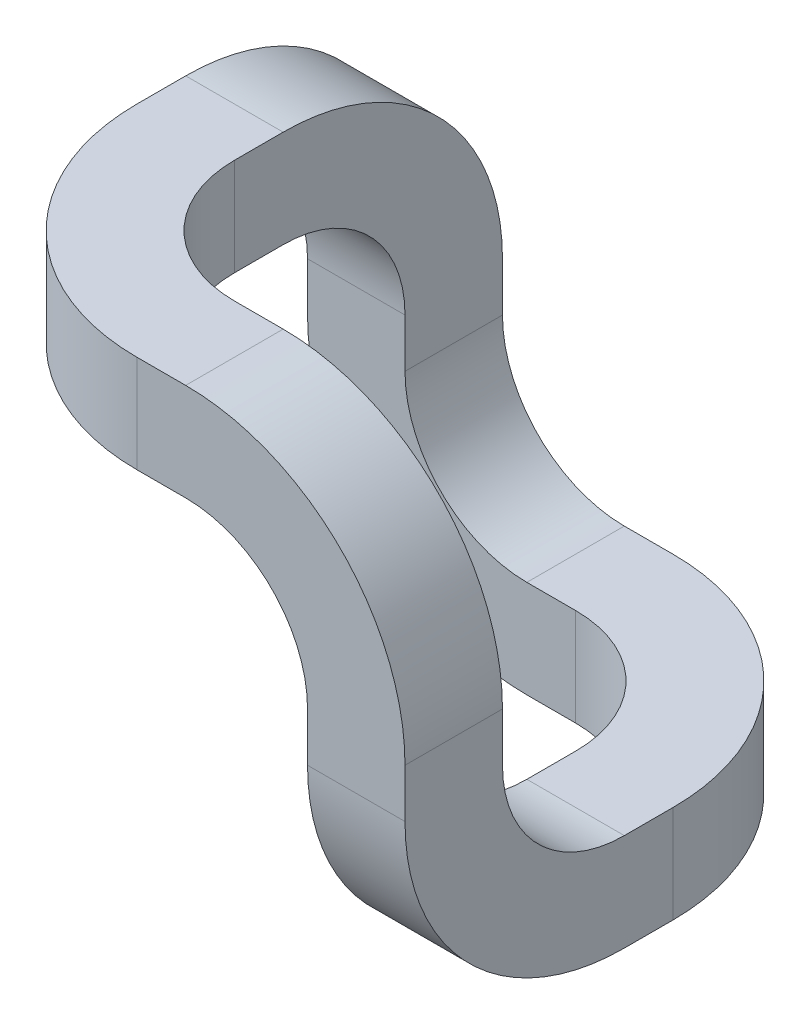
from build123d import *

# Parameters (mm, degrees)
SKETCH1_W               = 20
SKETCH1_H               = 20
BOSS_EXTRUDE1_DEPTH     = 10
SKETCH2_W               = 12
SKETCH2_H               = 12
CUT_EXTRUDE1_DEPTH      = 19
SKETCH3_W               = 12
SKETCH3_H               = 12
CUT_EXTRUDE2_DEPTH      = 31
SKETCH4_W               = 12
SKETCH4_H               = 12
CUT_EXTRUDE3_DEPTH      = 39
CUT_EXTRUDE5_DEPTH      = 21
CUT_EXTRUDE5_DEPTH_BACK = 6
SKETCH5_W               = 16
SKETCH5_H               = 16
CUT_EXTRUDE8_START      = 4
SKETCH6_W               = 17.478582849
SKETCH6_H               = 18.231479144
CUT_EXTRUDE8_DEPTH      = 43
FILLET3_R               = 9
FILLET4_R               = 9
FILLET5_R               = 9
FILLET6_R               = 9
FILLET7_R               = 9
FILLET8_R               = 9
FILLET9_R               = 5
FILLET10_R              = 5
FILLET11_R              = 5
FILLET12_R              = 5
FILLET13_R              = 5
FILLET14_R              = 5


with BuildPart() as part:
    # Sketch1 → Boss-Extrude1 (new, symmetric)
    with BuildSketch(Plane.XY):
        with Locations((10, 10)):
            Rectangle(SKETCH1_W, SKETCH1_H)
    extrude(amount=BOSS_EXTRUDE1_DEPTH, both=True)

    # Sketch2 → Cut-Extrude1 (cut, symmetric)
    with BuildSketch(Plane.XY):
        with Locations((10, 10)):
            Rectangle(SKETCH2_W, SKETCH2_H)
    extrude(amount=CUT_EXTRUDE1_DEPTH, both=True, mode=Mode.SUBTRACT)

    # Sketch3 → Cut-Extrude2 (cut, symmetric)
    with BuildSketch(Plane(origin=(0, 0, 0), x_dir=(1, 0, 0), z_dir=(0, 1, 0))):
        with Locations((10, 0)):
            Rectangle(SKETCH3_W, SKETCH3_H)
    extrude(amount=CUT_EXTRUDE2_DEPTH, both=True, mode=Mode.SUBTRACT)

    # Sketch4 → Cut-Extrude3 (cut, symmetric)
    with BuildSketch(Plane(origin=(0, 0, 0), x_dir=(0, 0, -1), z_dir=(1, 0, 0))):
        with Locations((0, 10)):
            Rectangle(SKETCH4_W, SKETCH4_H)
    extrude(amount=CUT_EXTRUDE3_DEPTH, both=True, mode=Mode.SUBTRACT)

    # Sketch5 → Cut-Extrude5 (cut, two sides: drawn at the far end of the back side and taken through both)
    with BuildSketch(Plane.XY.offset(-CUT_EXTRUDE5_DEPTH_BACK)):
        with Locations((8, 8)):
            Rectangle(SKETCH5_W, SKETCH5_H)
    extrude(amount=CUT_EXTRUDE5_DEPTH + CUT_EXTRUDE5_DEPTH_BACK, mode=Mode.SUBTRACT)

    # Sketch6 → Cut-Extrude8 (cut)
    with BuildSketch(Plane(origin=(0, 0, 0), x_dir=(1, 0, 0), z_dir=(0, 1, 0)).offset(CUT_EXTRUDE8_START)):
        with Locations((12.739291425, 3.115739572)):
            Rectangle(SKETCH6_W, SKETCH6_H)
    extrude(amount=CUT_EXTRUDE8_DEPTH, mode=Mode.SUBTRACT)

    # Fillet3
    fillet3_edges = [part.edges().sort_by_distance(p)[0] for p in [
        (20, 20, 8),
    ]]
    fillet(fillet3_edges, radius=FILLET3_R)

    # Fillet4
    fillet4_edges = [part.edges().sort_by_distance(p)[0] for p in [
        (0, 0, -8),
    ]]
    fillet(fillet4_edges, radius=FILLET4_R)

    # Fillet5
    fillet5_edges = [part.edges().sort_by_distance(p)[0] for p in [
        (20, 2, -10),
    ]]
    fillet(fillet5_edges, radius=FILLET5_R)

    # Fillet6
    fillet6_edges = [part.edges().sort_by_distance(p)[0] for p in [
        (0, 18, 10),
    ]]
    fillet(fillet6_edges, radius=FILLET6_R)

    # Fillet7
    fillet7_edges = [part.edges().sort_by_distance(p)[0] for p in [
        (2, 20, -10),
    ]]
    fillet(fillet7_edges, radius=FILLET7_R)

    # Fillet8
    fillet8_edges = [part.edges().sort_by_distance(p)[0] for p in [
        (18, 0, 10),
    ]]
    fillet(fillet8_edges, radius=FILLET8_R)

    # Fillet9
    fillet9_edges = [part.edges().sort_by_distance(p)[0] for p in [
        (4, 18, 6),
    ]]
    fillet(fillet9_edges, radius=FILLET9_R)

    # Fillet10
    fillet10_edges = [part.edges().sort_by_distance(p)[0] for p in [
        (16, 2, -6),
    ]]
    fillet(fillet10_edges, radius=FILLET10_R)

    # Fillet11
    fillet11_edges = [part.edges().sort_by_distance(p)[0] for p in [
        (16, 16, 8),
    ]]
    fillet(fillet11_edges, radius=FILLET11_R)

    # Fillet12
    fillet12_edges = [part.edges().sort_by_distance(p)[0] for p in [
        (4, 4, -8),
    ]]
    fillet(fillet12_edges, radius=FILLET12_R)

    # Fillet13
    fillet13_edges = [part.edges().sort_by_distance(p)[0] for p in [
        (18, 4, 6),
    ]]
    fillet(fillet13_edges, radius=FILLET13_R)

    # Fillet14
    fillet14_edges = [part.edges().sort_by_distance(p)[0] for p in [
        (2, 16, -6),
    ]]
    fillet(fillet14_edges, radius=FILLET14_R)


solid = part.part
